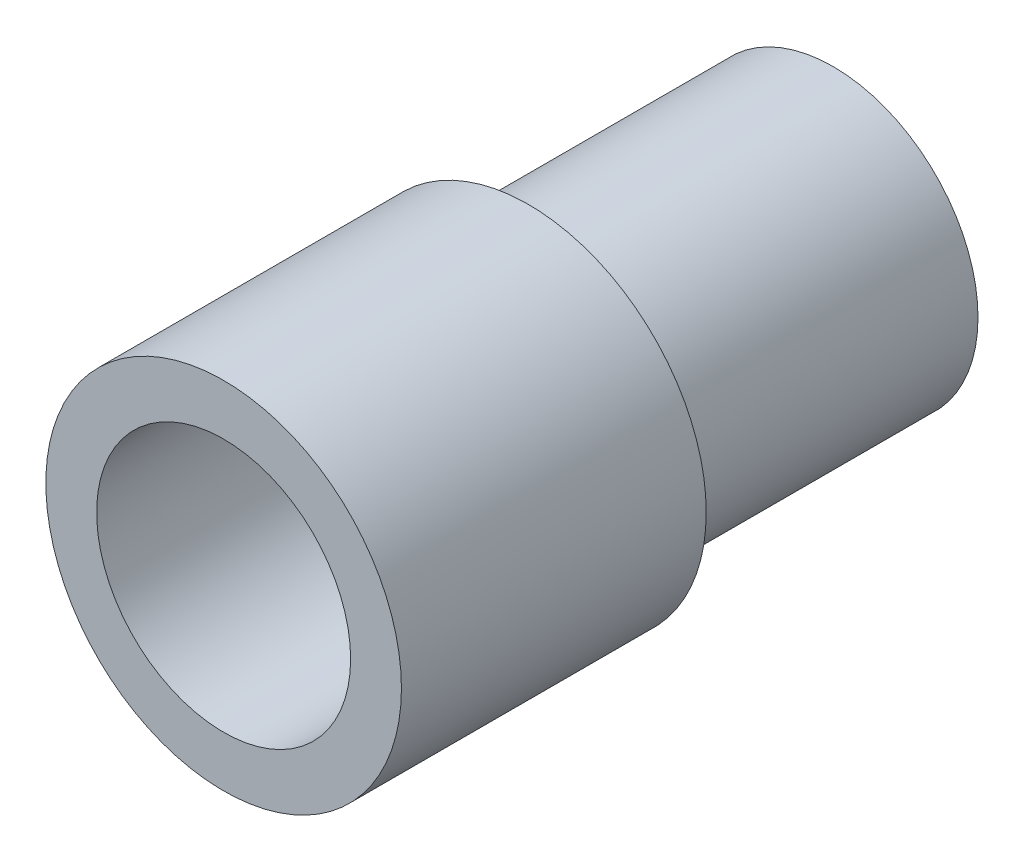
from build123d import *

# Parameters (mm, degrees)
SKETCH1_R           = 4.445
SKETCH1_R_2         = 3.175
BOSS_EXTRUDE1_DEPTH = 7.62
SKETCH2_R           = 3.6195
SKETCH2_R_2         = 1.5875
BOSS_EXTRUDE2_DEPTH = 7.62


with BuildPart() as part:
    # Sketch1 → Boss-Extrude1 (new body)
    with BuildSketch(Plane.XY):
        Circle(SKETCH1_R)
        Circle(SKETCH1_R_2, mode=Mode.SUBTRACT)
    extrude(amount=BOSS_EXTRUDE1_DEPTH)

    # Sketch2 → Boss-Extrude2 (add)
    with BuildSketch(Plane(origin=(0, 0, 0), x_dir=(-1, 0, 0), z_dir=(0, 0, -1))):
        with Locations(Location((0, 0, 0), (0, 0, 180))):
            Circle(SKETCH2_R)
        Circle(SKETCH2_R_2, mode=Mode.SUBTRACT)
    extrude(amount=BOSS_EXTRUDE2_DEPTH)


solid = part.part
